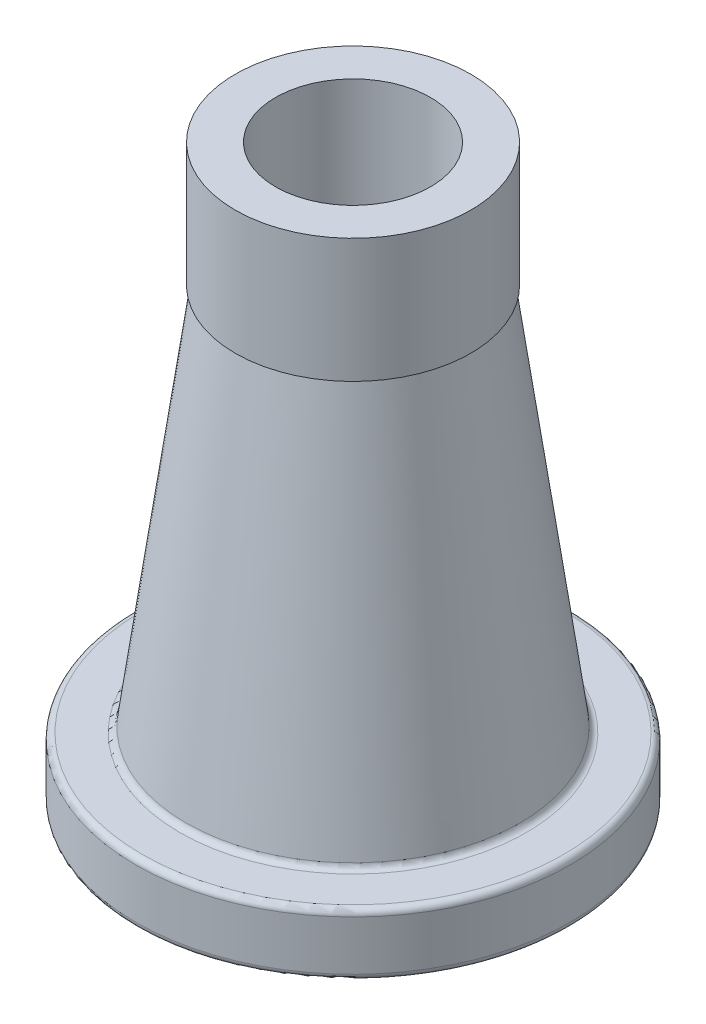
from build123d import *


with BuildPart() as part:
    # Sketch1 → Revolve1 (revolve)
    with BuildSketch(Plane.XY, mode=Mode.PRIVATE) as revolve1_sk:
        with BuildLine():
            Line((50, 1), (50, 0))
            Line((50, 0), (68, 0))
            ThreePointArc((68, 0), (69.414213562, 0.585786438), (70, 2))
            Line((70, 2), (70, 18))
            ThreePointArc((70, 18), (69.414213562, 19.414213562), (68, 20))
            Line((68, 20), (55.857196988, 20))
            ThreePointArc((55.857196988, 20), (54.542384187, 20.492927574), (53.87567887, 21.728732703))
            Line((53.87567887, 21.728732703), (46.5, 75.605633803))
            Line((46.5, 75.605633803), (37.077733397, 144.432183176))
            ThreePointArc((37.077733397, 144.432183176), (37.19634482, 144.8287032), (37.573112927, 145))
            Line((37.573112927, 145), (38, 145))
            Line((38, 145), (38, 185))
            Line((38, 185), (25, 185))
            Line((25, 185), (25, 145))
            Line((25, 145), (44, 3))
            Line((44, 3), (48, 3))
            ThreePointArc((48, 3), (49.414213562, 2.414213562), (50, 1))
        make_face()
    revolve(revolve1_sk.sketch.rotate(Axis((0, 185, 0), (0, -1, 0)), 90), axis=Axis((0, 185, 0), (0, -1, 0)))


solid = part.part
